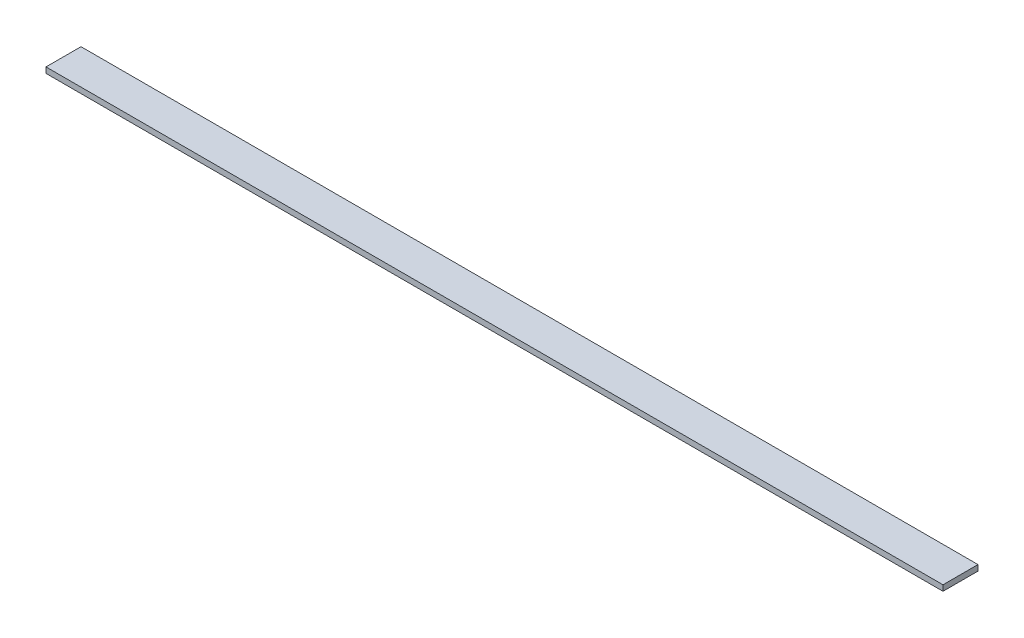
from build123d import *

# Parameters (mm, degrees)
SKETCH3_W           = 6019.8
SKETCH3_H           = 234.95
BOSS_EXTRUDE1_DEPTH = 38.1


with BuildPart() as part:
    # Sketch3 → Boss-Extrude1 (new body)
    with BuildSketch(Plane(origin=(0, 0, 0), x_dir=(1, 0, 0), z_dir=(0, 1, 0))):
        with Locations((-801.511111111, 1546.754166667)):
            Rectangle(SKETCH3_W, SKETCH3_H)
    extrude(amount=BOSS_EXTRUDE1_DEPTH)


solid = part.part
